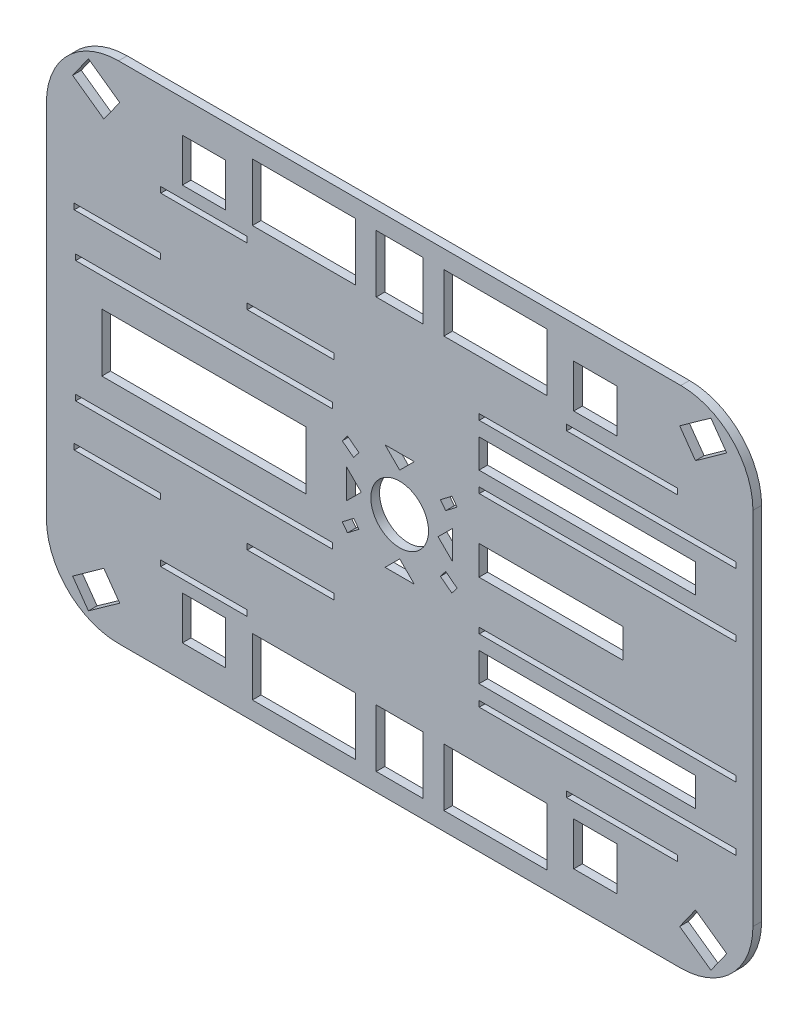
from build123d import *

# Parameters (mm, degrees)
SKETCH1_W           = 245
SKETCH1_H           = 175
BOSS_EXTRUDE1_DEPTH = 3
SKETCH2_W           = 30
SKETCH2_H           = 2
SKETCH2_W_2         = 70.850822781
SKETCH2_H_2         = 20.149065526
SKETCH2_W_3         = 88.999828845
SKETCH2_W_4         = 16.284036158
SKETCH2_H_3         = 20
SKETCH2_W_5         = 35.753967601
SKETCH2_W_6         = 15
SKETCH2_H_4         = 15
SKETCH2_R           = 10
CUT_EXTRUDE1_DEPTH  = 151.570581456
FILLET1_R           = 25
SKETCH2_4_W         = 89
SKETCH2_4_H         = 2
SKETCH2_4_W_2       = 50
SKETCH2_4_H_2       = 10.149065526
SKETCH2_4_W_3       = 75
SKETCH2_4_H_3       = 10
SKETCH2_4_W_4       = 15
SKETCH2_4_H_4       = 15
SKETCH2_4_W_5       = 35.753967601
SKETCH2_4_H_5       = 20
SKETCH2_4_W_6       = 38.395009933
CUT_EXTRUDE2_DEPTH  = 10
SKETCH2_5_W         = 16.284036158
SKETCH2_5_H         = 20
CUT_EXTRUDE3_DEPTH  = 10
CUT_EXTRUDE4_DEPTH  = 10
CUT_EXTRUDE5_DEPTH  = 10


with BuildPart() as part:
    # Sketch1 → Boss-Extrude1 (new body)
    with BuildSketch(Plane.XY):
        Rectangle(SKETCH1_W, SKETCH1_H)
    extrude(amount=BOSS_EXTRUDE1_DEPTH)

    # Sketch2 → Cut-Extrude1 (cut, through all)
    with BuildSketch(Plane.XY.offset(3)):
        with Locations((-37.857152872, 36.074532763)):
            Rectangle(SKETCH2_W, SKETCH2_H)
        with Locations((-67.857152873, 0)):
            Rectangle(SKETCH2_W_2, SKETCH2_H_2)
        with Locations((-67.857152873, 21.074532763)):
            Rectangle(SKETCH2_W_3, SKETCH2_H)
        with Locations((-97.857152872, 36.074532763)):
            Rectangle(SKETCH2_W, SKETCH2_H)
        with Locations((-67.857152872, 56.074532763)):
            Rectangle(SKETCH2_W, SKETCH2_H)
        with Locations((0, 71.241154444)):
            Rectangle(SKETCH2_W_4, SKETCH2_H_3)
        with Locations((-33.197326406, 71.241154444)):
            Rectangle(SKETCH2_W_5, SKETCH2_H_3)
        with Locations((-67.857152872, 68.74)):
            Rectangle(SKETCH2_W_6, SKETCH2_H_4)
        Polygon((-110.669619636, 79.049728312), (-113.412388394, 75.188417537), (-102.577806523, 67.449430486), (-97.092269008, 75.172052036), (-107.926850879, 82.911039086), align=None)
        Polygon((-110.669619636, -79.049728312), (-107.926850879, -82.911039086), (-97.092269008, -75.172052036), (-102.577806523, -67.449430486), (-113.412388394, -75.188417537), align=None)
        with Locations((-67.857152872, -68.74)):
            Rectangle(SKETCH2_W_6, SKETCH2_H_4)
        with Locations((-33.197326406, -71.241154444)):
            Rectangle(SKETCH2_W_5, SKETCH2_H_3)
        with Locations((-67.857152872, -56.074532763)):
            Rectangle(SKETCH2_W, SKETCH2_H)
        with Locations((-97.857152872, -36.074532763)):
            Rectangle(SKETCH2_W, SKETCH2_H)
        with Locations((-37.857152872, -36.074532763)):
            Rectangle(SKETCH2_W, SKETCH2_H)
        with Locations((-67.857152873, -21.074532763)):
            Rectangle(SKETCH2_W_3, SKETCH2_H)
        Circle(SKETCH2_R)
    extrude(amount=-CUT_EXTRUDE1_DEPTH, mode=Mode.SUBTRACT)

    # Fillet1
    fillet1_edges = [part.edges().sort_by_distance(p)[0] for p in [
        (-122.5, -87.5, 1.5),
        (122.5, -87.5, 1.5),
        (122.5, 87.5, 1.5),
        (-122.5, 87.5, 1.5),
    ]]
    fillet(fillet1_edges, radius=FILLET1_R)

    # Sketch2<4> → Cut-Extrude2 (cut)
    with BuildSketch(Plane.XY.offset(3)):
        with Locations((72.091101618, -43.074532763)):
            Rectangle(SKETCH2_4_W, SKETCH2_4_H)
        with Locations((52.502938646, 0)):
            Rectangle(SKETCH2_4_W_2, SKETCH2_4_H_2)
        with Locations((72.091101618, -21.074532763)):
            Rectangle(SKETCH2_4_W, SKETCH2_4_H)
        with Locations((65.002938646, -32.074532763)):
            Rectangle(SKETCH2_4_W_3, SKETCH2_4_H_3)
        Polygon((97.092269008, -75.172052036), (107.926850879, -82.911039086), (113.412388394, -75.188417537), (102.577806523, -67.449430486), align=None)
        with Locations((67.857152872, -68.74)):
            Rectangle(SKETCH2_4_W_4, SKETCH2_4_H_4)
        with Locations((33.197326406, -71.241154444)):
            Rectangle(SKETCH2_4_W_5, SKETCH2_4_H_5)
        Polygon((97.092269008, 75.172052036), (102.577806523, 67.449430486), (113.412388394, 75.188417537), (107.926850879, 82.911039086), align=None)
        with Locations((67.857152872, 68.74)):
            Rectangle(SKETCH2_4_W_4, SKETCH2_4_H_4)
        with Locations((33.197326406, 71.241154444)):
            Rectangle(SKETCH2_4_W_5, SKETCH2_4_H_5)
        with Locations((72.091101618, 43.074532763)):
            Rectangle(SKETCH2_4_W, SKETCH2_4_H)
        with Locations((72.091101618, 21.074532763)):
            Rectangle(SKETCH2_4_W, SKETCH2_4_H)
        with Locations((65.002938646, 32.074532763)):
            Rectangle(SKETCH2_4_W_3, SKETCH2_4_H_3)
        with Locations((77.104345869, 55.074532763)):
            Rectangle(SKETCH2_4_W_6, SKETCH2_4_H)
        with Locations((77.104345869, -55.074532763)):
            Rectangle(SKETCH2_4_W_6, SKETCH2_4_H)
    extrude(amount=-CUT_EXTRUDE2_DEPTH, mode=Mode.SUBTRACT)

    # Sketch2<5> → Cut-Extrude3 (cut)
    with BuildSketch(Plane.XY.offset(3)):
        with Locations((0, -71.241154444)):
            Rectangle(SKETCH2_5_W, SKETCH2_5_H)
    extrude(amount=-CUT_EXTRUDE3_DEPTH, mode=Mode.SUBTRACT)

    # Sketch2<6> → Cut-Extrude4 (cut)
    with BuildSketch(Plane.XY.offset(3)):
        Polygon((-13.32970408, 0), (-18.404236844, 5.074532763), (-18.404236844, -5.074532763), align=None)
        Polygon((-5.074532763, 18.404236844), (0, 13.32970408), (5.074532763, 18.404236844), align=None)
        Polygon((18.404236844, 5.074532763), (13.32970408, 0), (18.404236844, -5.074532763), align=None)
        Polygon((5.074532763, -18.404236844), (0, -13.32970408), (-5.074532763, -18.404236844), align=None)
    extrude(amount=-CUT_EXTRUDE4_DEPTH, mode=Mode.SUBTRACT)

    # Sketch2<7> → Cut-Extrude5 (cut)
    with BuildSketch(Plane.XY.offset(3)):
        Polygon((19.919957162, -12.170770236), (15.95504041, -9.124553707), (14.127310492, -11.503503759), (18.092227245, -14.549720288), align=None)
        Polygon((19.919957162, 12.170770236), (18.092227245, 14.549720288), (14.127310492, 11.503503759), (15.95504041, 9.124553707), align=None)
        Polygon((-18.092227245, 14.549720288), (-19.919957162, 12.170770236), (-15.95504041, 9.124553707), (-14.127310492, 11.503503759), align=None)
        Polygon((-19.919957162, -12.170770236), (-18.092227245, -14.549720288), (-14.127310492, -11.503503759), (-15.95504041, -9.124553707), align=None)
    extrude(amount=-CUT_EXTRUDE5_DEPTH, mode=Mode.SUBTRACT)


solid = part.part
